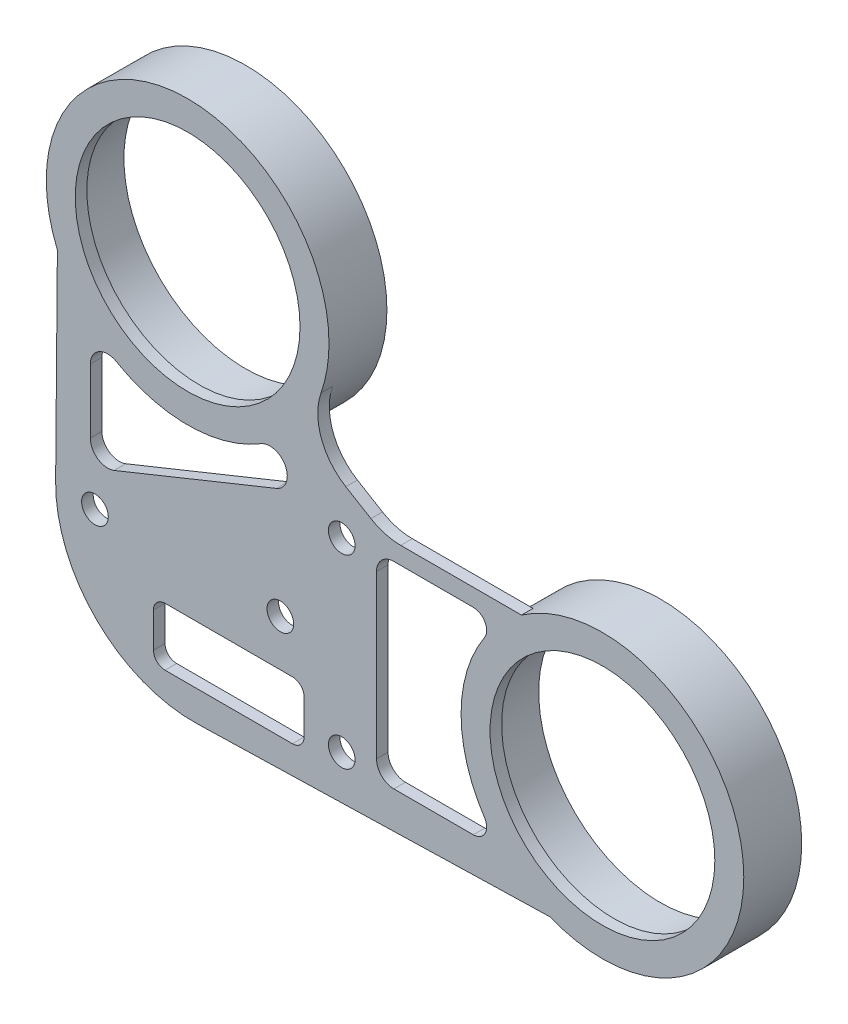
from build123d import *
from build123d.topology import SkipClean

# Parameters (mm, degrees)
EXTRUDE_1_DEPTH     = 1
SKETCH_3_R          = 9.7
SKETCH_3_R_2        = 1.15
CUT_EXTRUDE_1_DEPTH = 60.104137335
SKETCH_4_R          = 12.2
SKETCH_4_R_2        = 10.5
EXTRUDE_2_DEPTH     = 4
CUT_EXTRUDE_2_DEPTH = 60.230896077


with BuildPart() as part:
    # 草图2 → 凸台-拉伸1 (new body)
    with BuildSketch(Plane.XY):
        with BuildLine():
            Line((-47.999535461, 22.106463733), (-48.193482209, -0.117632256))
            ThreePointArc((-48.193482209, -0.117632256), (-44.33750525, -9.426784127), (-34.962475131, -13.1197067))
            Line((-34.962475131, -13.1197067), (0.319358769, -12.195819365))
            ThreePointArc((0.319358769, -12.195819365), (11.588061422, 3.815341724), (-6.988562084, 10))
            Line((-6.988562084, 10), (-17.408374558, 10))
            ThreePointArc((-17.408374558, 10), (-18.744566439, 10.181847734), (-19.983564933, 10.714163496))
            Line((-19.983564933, 10.714163496), (-22.14712826, 12.014163496))
            ThreePointArc((-22.14712826, 12.014163496), (-24.275653905, 14.604401107), (-24.289397802, 17.956976744))
            ThreePointArc((-24.289397802, 17.956976744), (-33.696855253, 34.017353376), (-47.999535461, 22.106463733))
        make_face()
    extrude(amount=-EXTRUDE_1_DEPTH)

    # 草图3 → 切除-拉伸1 (cut, through all)
    with BuildSketch(Plane.XY):
        with BuildLine():
            ThreePointArc((-18, 8.5), (-19.060660172, 8.060660172), (-19.5, 7))
            Line((-19.5, 7), (-19.5, -7))
            ThreePointArc((-19.5, -7), (-19.060660172, -8.060660172), (-18, -8.5))
            Line((-18, -8.5), (-11.144505373, -8.5))
            ThreePointArc((-11.144505373, -8.5), (-10.131929949, -7.895152283), (-10.184491801, -6.716853933))
            ThreePointArc((-10.184491801, -6.716853933), (-12.2, 0), (-10.184491801, 6.716853933))
            ThreePointArc((-10.184491801, 6.716853933), (-10.131929949, 7.895152283), (-11.144505373, 8.5))
            Line((-11.144505373, 8.5), (-18, 8.5))
        make_face()
        with BuildLine():
            ThreePointArc((-41.944525547, 11.460322311), (-43.44725776, 11.465077783), (-44.2, 10.1644603))
            Line((-44.2, 10.1644603), (-44.2, 4.626978026))
            ThreePointArc((-44.2, 4.626978026), (-43.538789355, 3.383421667), (-42.13809011, 3.236202244))
            Line((-42.13809011, 3.236202244), (-28.13809011, 8.892569405))
            ThreePointArc((-28.13809011, 8.892569405), (-27.358855493, 10.955157224), (-29.477372263, 11.566190605))
            ThreePointArc((-29.477372263, 11.566190605), (-35.696404047, 9.800439849), (-41.944525547, 11.460322311))
        make_face()
        with BuildLine():
            Line((-26.75, -4.5), (-37.75, -4.5))
            ThreePointArc((-37.75, -4.5), (-38.457106781, -4.792893219), (-38.75, -5.5))
            Line((-38.75, -5.5), (-38.75, -8.5))
            ThreePointArc((-38.75, -8.5), (-38.457106781, -9.207106781), (-37.75, -9.5))
            Line((-37.75, -9.5), (-26.75, -9.5))
            ThreePointArc((-26.75, -9.5), (-26.042893219, -9.207106781), (-25.75, -8.5))
            Line((-25.75, -8.5), (-25.75, -5.5))
            ThreePointArc((-25.75, -5.5), (-26.042893219, -4.792893219), (-26.75, -4.5))
        make_face()
        Circle(SKETCH_3_R)
        with Locations((-35.8, 22)):
            Circle(SKETCH_3_R)
        with Locations((-43.8, -0.5)):
            Circle(SKETCH_3_R_2)
        with Locations((-27.8, -0.5)):
            Circle(SKETCH_3_R_2)
        with Locations((-22.5, 8)):
            Circle(SKETCH_3_R_2)
        with Locations((-22.5, -8)):
            Circle(SKETCH_3_R_2)
    extrude(amount=-CUT_EXTRUDE_1_DEPTH, mode=Mode.SUBTRACT)

    # 草图4 → 凸台-拉伸2 (add)
    # profile 1 of 2: a face of its own
    with BuildSketch(Plane.XY.offset(-1)):
        with Locations((-35.8, 22)):
            Circle(SKETCH_4_R)
        with Locations((-35.8, 22)):
            Circle(SKETCH_4_R_2, mode=Mode.SUBTRACT)
    # profile 2 of 2: a face of its own
    with BuildSketch(Plane.XY.offset(-1)):
        Circle(SKETCH_4_R)
        Circle(SKETCH_4_R_2, mode=Mode.SUBTRACT)
    extrude(amount=-EXTRUDE_2_DEPTH)

    # 草图6 → 切除-拉伸2 (cut, through all)
    with SkipClean():  # the faces are left unmerged after this step: merging them gives an invalid solid
        with BuildSketch(Plane(origin=(0, 0, -1), x_dir=(-1, 0, 0), z_dir=(0, 0, -1))):
            with BuildLine():
                Line((47.999535461, 22.106463733), (48.193482209, -0.117632256))
                ThreePointArc((48.193482209, -0.117632256), (44.33750525, -9.426784127), (34.962475131, -13.1197067))
                Line((34.962475131, -13.1197067), (-0.319358769, -12.195819365))
                ThreePointArc((-0.319358769, -12.195819365), (2.156225392, -12.007942874), (4.542515187, -11.322789222))
                Line((4.542515187, -11.322789222), (34.988652079, -12.120049375))
                ThreePointArc((34.988652079, -12.120049375), (43.636595985, -8.713533678), (47.193520286, -0.126358792))
                Line((47.193520286, -0.126358792), (47.041786885, 17.26056674))
                ThreePointArc((47.041786885, 17.26056674), (47.768482684, 19.634535512), (47.999535461, 22.106463733))
            make_face()
        extrude(amount=-CUT_EXTRUDE_2_DEPTH, mode=Mode.SUBTRACT)


solid = part.part
